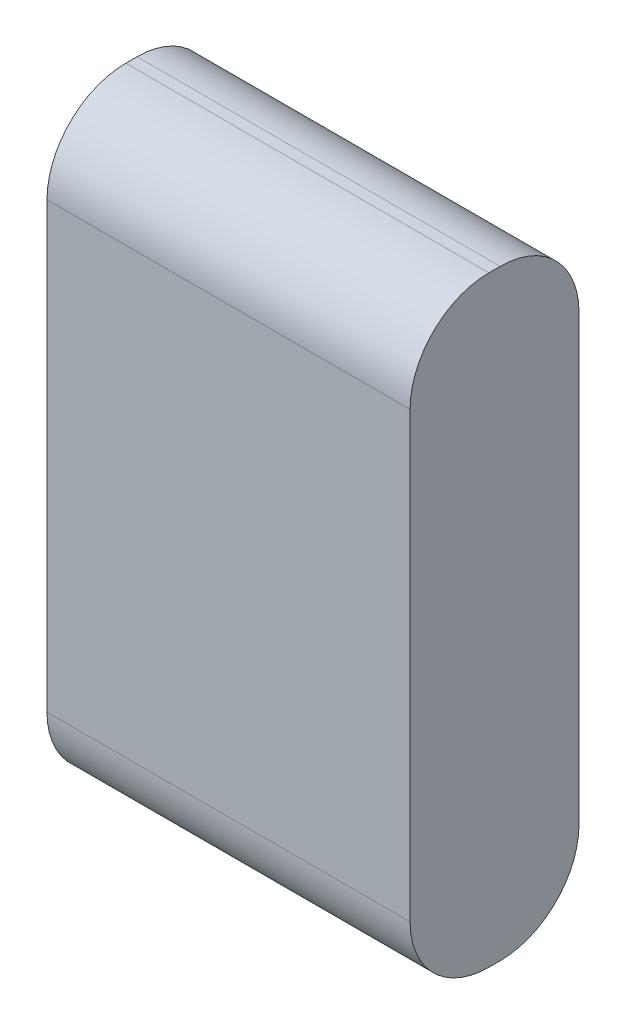
from build123d import *

# Parameters (mm, degrees)
SKETCH2_W           = 80.6
SKETCH2_H           = 37.5
BOSS_EXTRUDE1_DEPTH = 133.5
FILLET1_R           = 17.5


with BuildPart() as part:
    # Sketch2 → Boss-Extrude1 (new body)
    with BuildSketch(Plane(origin=(0, 0, 0), x_dir=(1, 0, 0), z_dir=(0, 1, 0))):
        with Locations((40.3, 18.75)):
            Rectangle(SKETCH2_W, SKETCH2_H)
    extrude(amount=BOSS_EXTRUDE1_DEPTH)

    # Fillet1
    fillet1_edges = [part.edges().sort_by_distance(p)[0] for p in [
        (40.3, 133.5, -37.5),
        (40.3, 0, -37.5),
        (40.3, 0, 0),
        (40.3, 133.5, 0),
    ]]
    fillet(fillet1_edges, radius=FILLET1_R)


solid = part.part
